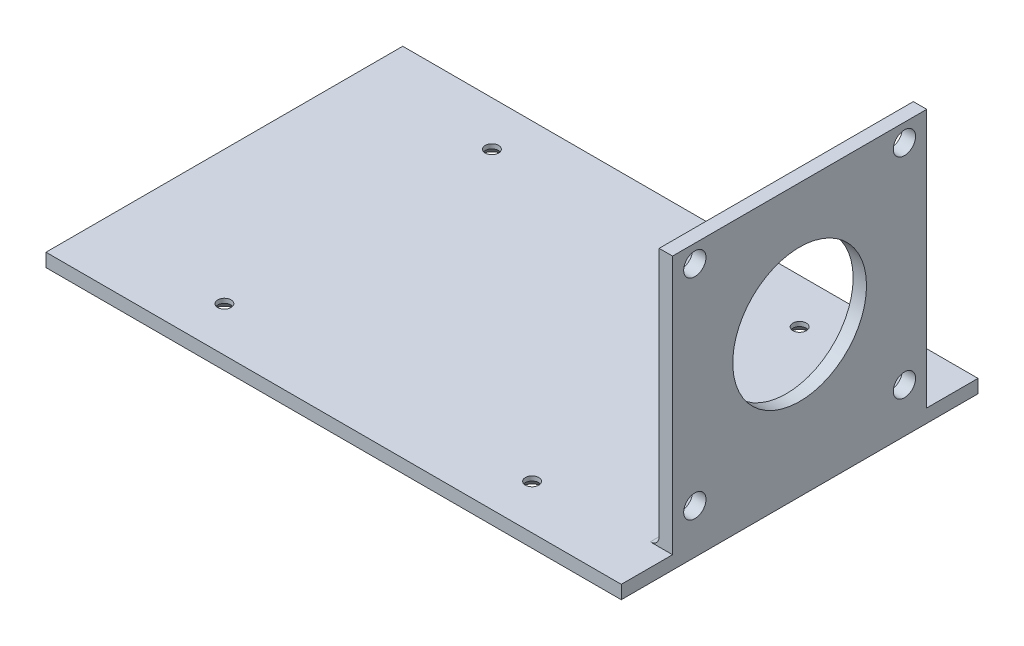
from build123d import *

# Parameters (mm, degrees)
SKETCH1_W           = 129
SKETCH1_H           = 80
SKETCH1_R           = 1.5
BOSS_EXTRUDE1_DEPTH = 3
SKETCH2_W           = 3
SKETCH2_H           = 57
BOSS_EXTRUDE2_DEPTH = 58
FILLET1_R           = 2
SKETCH3_R           = 2.5
SKETCH3_R_2         = 15
CUT_EXTRUDE1_DEPTH  = 164.590953295
CHAMFER3_SIZE       = 2


with BuildPart() as part:
    # Sketch1 → Boss-Extrude1 (new body)
    with BuildSketch(Plane(origin=(0, 0, 0), x_dir=(1, 0, 0), z_dir=(0, 1, 0))):
        with Locations((64.5, 40)):
            Rectangle(SKETCH1_W, SKETCH1_H)
        with Locations(Location((99, 70, 0), (0, 0, 270))):
            Circle(SKETCH1_R, mode=Mode.SUBTRACT)
        with Locations(Location((30, 70, 0), (0, 0, 270))):
            Circle(SKETCH1_R, mode=Mode.SUBTRACT)
        with Locations(Location((99, 10, 0), (0, 0, 90))):
            Circle(SKETCH1_R, mode=Mode.SUBTRACT)
        with Locations(Location((30, 10, 0), (0, 0, 90))):
            Circle(SKETCH1_R, mode=Mode.SUBTRACT)
    extrude(amount=BOSS_EXTRUDE1_DEPTH)

    # Sketch2 → Boss-Extrude2 (add)
    with BuildSketch(Plane(origin=(0, 3, 0), x_dir=(1, 0, 0), z_dir=(0, 1, 0))):
        with Locations((127.5, 40)):
            Rectangle(SKETCH2_W, SKETCH2_H)
    extrude(amount=BOSS_EXTRUDE2_DEPTH)

    # Fillet1
    fillet1_edges = [part.edges().sort_by_distance(p)[0] for p in [
        (126, 3, -40),
    ]]
    fillet(fillet1_edges, radius=FILLET1_R)

    # Sketch3 → Cut-Extrude1 (cut, through all)
    with BuildSketch(Plane(origin=(129, 0, 0), x_dir=(0, 0, -1), z_dir=(1, 0, 0))):
        with Locations((16.5, 57)):
            Circle(SKETCH3_R)
        with Locations((40, 33.5)):
            Circle(SKETCH3_R_2)
        with Locations((63.5, 57)):
            Circle(SKETCH3_R)
        with Locations((16.5, 10)):
            Circle(SKETCH3_R)
        with Locations((63.5, 10)):
            Circle(SKETCH3_R)
    extrude(amount=-CUT_EXTRUDE1_DEPTH, mode=Mode.SUBTRACT)

    # Chamfer3
    chamfer3_edges = [part.edges().sort_by_distance(p)[0] for p in [
        (99, 0, -71.5),
        (30, 0, -71.5),
        (99, 0, -8.5),
        (30, 0, -8.5),
    ]]
    chamfer(chamfer3_edges, length=CHAMFER3_SIZE)


solid = part.part
